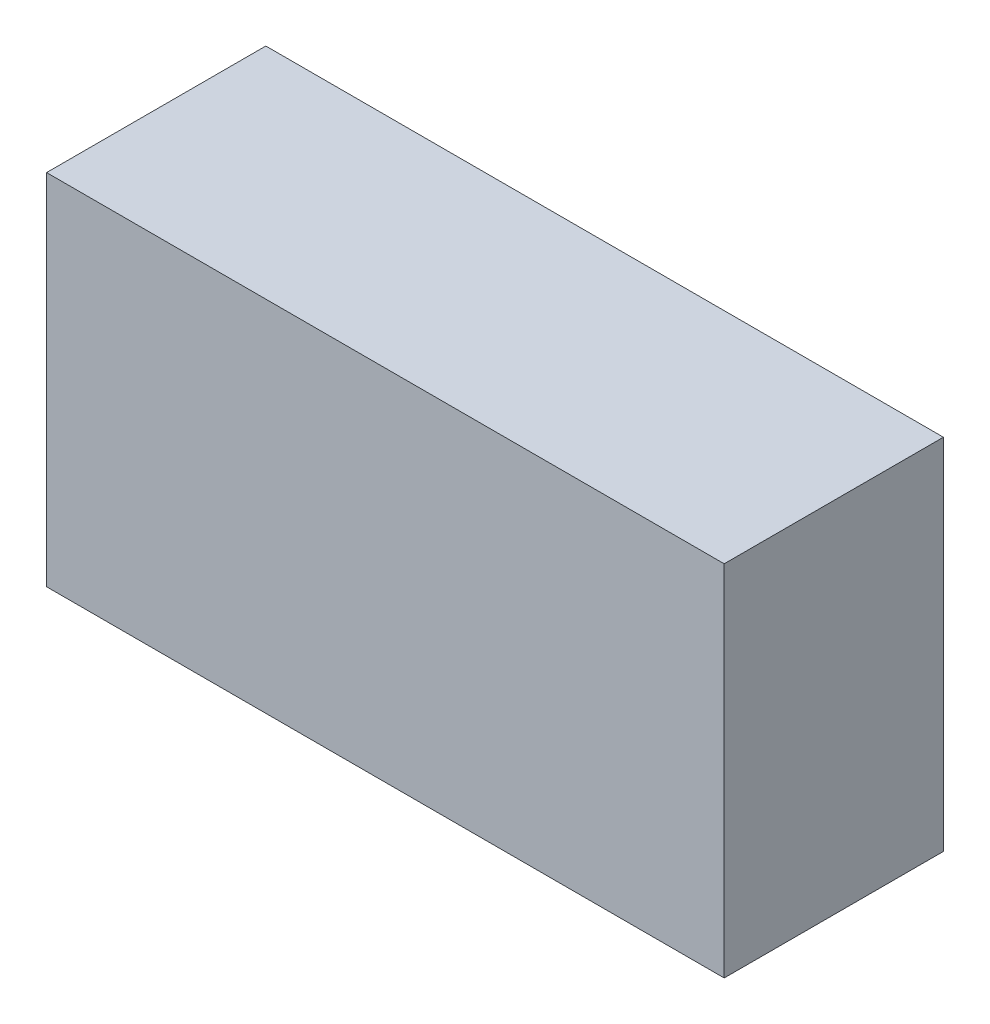
from build123d import *

# Parameters (mm, degrees)
SKETCH1_W           = 34
SKETCH1_H           = 18
BOSS_EXTRUDE1_DEPTH = 11


with BuildPart() as part:
    # Sketch1 → Boss-Extrude1 (new body)
    with BuildSketch(Plane.XY.offset(-17)):
        with Locations((20, 14)):
            Rectangle(SKETCH1_W, SKETCH1_H)
    extrude(amount=BOSS_EXTRUDE1_DEPTH)


solid = part.part
